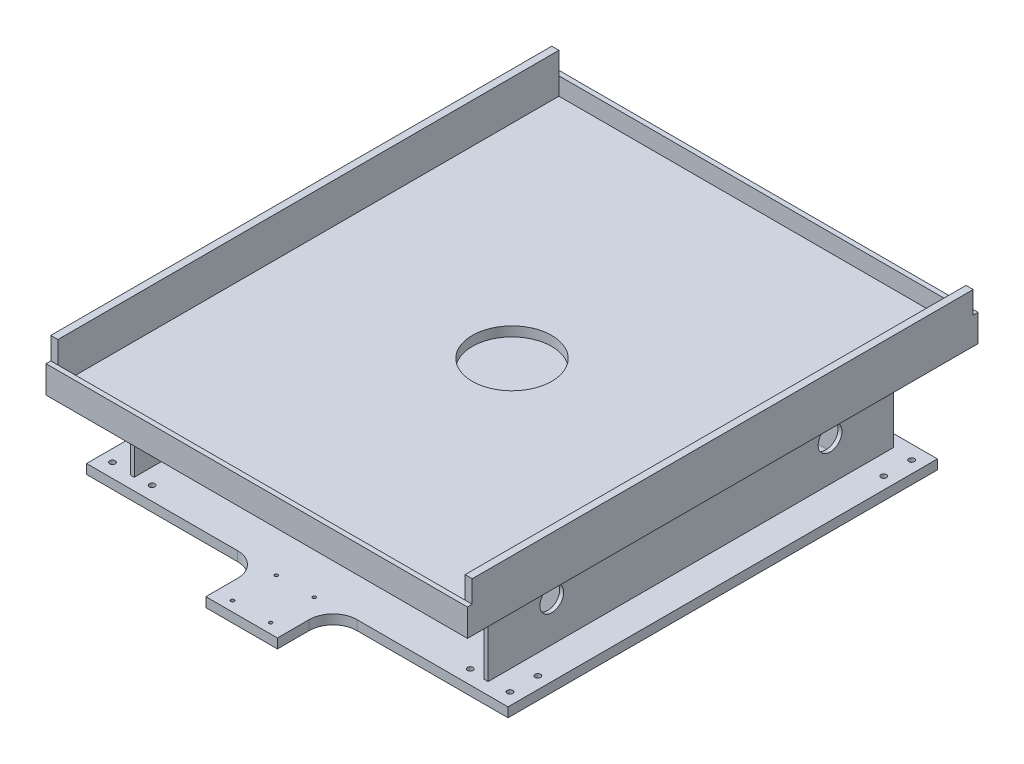
from build123d import *

# Parameters (mm, degrees)
SKETCH1_W                    = 530
SKETCH1_H                    = 680
BOSS_EXTRUDE1_DEPTH          = 12
BOSS_EXTRUDE2_START          = 220
SKETCH2_W                    = 510
SKETCH2_H                    = 100
BOSS_EXTRUDE2_DEPTH          = 5
BOSS_EXTRUDE3_START          = -220
SKETCH3_W                    = 510
SKETCH3_H                    = 100
BOSS_EXTRUDE3_DEPTH          = 5
SKETCH4_W                    = 50
SKETCH4_H                    = 100
SKETCH4_W_2                  = 44
SKETCH4_H_2                  = 94
EXTRUDE_THIN1_DEPTH          = 440
EXTRUDE_THIN1_2_DEPTH        = 440
SKETCH5_W                    = 530
SKETCH5_H                    = 642
BOSS_EXTRUDE4_DEPTH          = 62
SHELL1_T                     = -9
SHELL1_THICKNESS_2_FACE_W    = 624
SHELL1_THICKNESS_2_FACE_H    = 512
SHELL1_THICKNESS_2_DEPTH     = 3
SHELL1_THICKNESS_3_FACE_W    = 512
SHELL1_THICKNESS_3_FACE_H    = 50
SHELL1_THICKNESS_3_DEPTH     = 3
SHELL1_THICKNESS_4_FACE_W    = 512
SHELL1_THICKNESS_4_FACE_H    = 50
SHELL1_THICKNESS_4_DEPTH     = 3
FILLET1_R                    = 6
FILLET2_R                    = 9
FILLET3_R                    = 6
FILLET4_R                    = 9
SKETCH6_W                    = 530
SKETCH6_H                    = 6
CUT_EXTRUDE1_DEPTH           = 27.8
SKETCH7_W                    = 220
SKETCH7_H                    = 70
CUT_EXTRUDE2_DEPTH           = 748.575414256
SKETCH8_R                    = 50
CUT_EXTRUDE3_DEPTH           = 741.270896362
SKETCH9_R                    = 15
CUT_EXTRUDE4_DEPTH           = 857.023364167
M5X0_8_TAPPED_HOLE1_D        = 4.2
M5X0_8_TAPPED_HOLE1_DEPTH    = 12
LPATTERN1_COUNT              = 2
LPATTERN1_PITCH              = 600
F_7_0_7_DIAMETER_HOLE1_D     = 7
F_7_0_7_DIAMETER_HOLE1_DEPTH = 12
LPATTERN2_COUNT              = 2
LPATTERN2_PITCH              = 470
LPATTERN2_COPY_1_D           = 7
LPATTERN2_COPY_1_DEPTH       = 12
FILLET5_R                    = 30


with BuildPart() as part:
    # Sketch1 → Boss-Extrude1 (new body)
    with BuildSketch(Plane(origin=(0, 0, 0), x_dir=(1, 0, 0), z_dir=(0, 1, 0))):
        with Locations((0, 340)):
            Rectangle(SKETCH1_W, SKETCH1_H)
    extrude(amount=BOSS_EXTRUDE1_DEPTH)

    # Sketch2 → Boss-Extrude2 (add)
    with BuildSketch(Plane(origin=(0, 0, 0), x_dir=(0, 0, -1), z_dir=(1, 0, 0)).offset(BOSS_EXTRUDE2_START)):
        with Locations((340, 62)):
            Rectangle(SKETCH2_W, SKETCH2_H)
    extrude(amount=BOSS_EXTRUDE2_DEPTH)

    # Sketch3 → Boss-Extrude3 (add)
    with BuildSketch(Plane(origin=(0, 0, 0), x_dir=(0, 0, -1), z_dir=(1, 0, 0)).offset(BOSS_EXTRUDE3_START)):
        with Locations((340, 62)):
            Rectangle(SKETCH3_W, SKETCH3_H)
    extrude(amount=-BOSS_EXTRUDE3_DEPTH)


with BuildPart() as body_2:
    # Sketch4 → Extrude-Thin1 (new body)
    with BuildSketch(Plane(origin=(-220, 0, 0), x_dir=(0, 0, -1), z_dir=(1, 0, 0))):
        with Locations((160, 62)):
            Rectangle(SKETCH4_W, SKETCH4_H)
        with Locations((160, 62)):
            Rectangle(SKETCH4_W_2, SKETCH4_H_2, mode=Mode.SUBTRACT)
    extrude(amount=EXTRUDE_THIN1_DEPTH)

    # Fillet1
    fillet1_edges = [body_2.edges().sort_by_distance(p)[0] for p in [
        (0, 109, -182),
        (0, 109, -138),
        (0, 15, -182),
        (0, 15, -138),
    ]]
    fillet(fillet1_edges, radius=FILLET1_R)

    # Fillet2
    fillet2_edges = [body_2.edges().sort_by_distance(p)[0] for p in [
        (0, 112, -135),
        (0, 112, -185),
        (0, 12, -185),
        (0, 12, -135),
    ]]
    fillet(fillet2_edges, radius=FILLET2_R)


with BuildPart() as body_3:
    # Sketch4 → Extrude-Thin1 2 (new body)
    with BuildSketch(Plane(origin=(-220, 0, 0), x_dir=(0, 0, -1), z_dir=(1, 0, 0))):
        with Locations((520, 62)):
            Rectangle(SKETCH4_W, SKETCH4_H)
        with Locations((520, 62)):
            Rectangle(SKETCH4_W_2, SKETCH4_H_2, mode=Mode.SUBTRACT)
    extrude(amount=EXTRUDE_THIN1_2_DEPTH)

    # Fillet3
    fillet3_edges = [body_3.edges().sort_by_distance(p)[0] for p in [
        (0, 109, -542),
        (0, 109, -498),
        (0, 15, -542),
        (0, 15, -498),
    ]]
    fillet(fillet3_edges, radius=FILLET3_R)

    # Fillet4
    fillet4_edges = [body_3.edges().sort_by_distance(p)[0] for p in [
        (0, 112, -495),
        (0, 112, -545),
        (0, 12, -545),
        (0, 12, -495),
    ]]
    fillet(fillet4_edges, radius=FILLET4_R)


with BuildPart() as body_4:
    # Sketch5 → Boss-Extrude4 (new body)
    with BuildSketch(Plane(origin=(0, 112, 0), x_dir=(1, 0, 0), z_dir=(0, 1, 0))):
        with Locations((0, 340)):
            Rectangle(SKETCH5_W, SKETCH5_H)
    extrude(amount=BOSS_EXTRUDE4_DEPTH)

    # Shell1
    shell1_openings = [body_4.faces().sort_by_distance(p)[0] for p in [
        (0, 174, -340),
    ]]
    offset(amount=SHELL1_T, openings=shell1_openings, kind=Kind.INTERSECTION)

    # Shell1 thickness 2 face (on inner face of the shell) → Shell1 thickness 2 (add)
    with BuildSketch(Plane(origin=(0, 121, -340), x_dir=(0, 0, -1), z_dir=(0, -1, 0))):
        Rectangle(SHELL1_THICKNESS_2_FACE_W, SHELL1_THICKNESS_2_FACE_H)
    extrude(amount=-SHELL1_THICKNESS_2_DEPTH)

    # Shell1 thickness 3 face (on inner face of the shell) → Shell1 thickness 3 (cut)
    with BuildSketch(Plane(origin=(0, 149, -28), x_dir=(1, 0, 0), z_dir=(0, 0, 1))):
        Rectangle(SHELL1_THICKNESS_3_FACE_W, SHELL1_THICKNESS_3_FACE_H)
    extrude(amount=SHELL1_THICKNESS_3_DEPTH, mode=Mode.SUBTRACT)

    # Shell1 thickness 4 face (on inner face of the shell) → Shell1 thickness 4 (cut)
    with BuildSketch(Plane(origin=(0, 149, -652), x_dir=(-1, 0, 0), z_dir=(0, 0, -1))):
        Rectangle(SHELL1_THICKNESS_4_FACE_W, SHELL1_THICKNESS_4_FACE_H)
    extrude(amount=SHELL1_THICKNESS_4_DEPTH, mode=Mode.SUBTRACT)

    # Combine1: union body 2, body 3, part
    add(body_2.part)
    add(body_3.part)
    add(part.part)

    # Sketch6 → Cut-Extrude1 (cut)
    with BuildSketch(Plane(origin=(0, 174, 0), x_dir=(1, 0, 0), z_dir=(0, 1, 0))):
        with Locations((0, 22)):
            Rectangle(SKETCH6_W, SKETCH6_H)
        with Locations((0, 658)):
            Rectangle(SKETCH6_W, SKETCH6_H)
    extrude(amount=-CUT_EXTRUDE1_DEPTH, mode=Mode.SUBTRACT)

    # Sketch7 → Cut-Extrude2 (cut, through all)
    with BuildSketch(Plane(origin=(0, 12, 0), x_dir=(1, 0, 0), z_dir=(0, 1, 0))):
        with Locations((-155, 35)):
            Rectangle(SKETCH7_W, SKETCH7_H)
        with Locations((155, 35)):
            Rectangle(SKETCH7_W, SKETCH7_H)
        with Locations((155, 645)):
            Rectangle(SKETCH7_W, SKETCH7_H)
        with Locations((-155, 645)):
            Rectangle(SKETCH7_W, SKETCH7_H)
    extrude(amount=-CUT_EXTRUDE2_DEPTH, mode=Mode.SUBTRACT)

    # Sketch8 → Cut-Extrude3 (cut, through all)
    with BuildSketch(Plane(origin=(0, 124, 0), x_dir=(1, 0, 0), z_dir=(0, 1, 0))):
        with Locations(Location((0, 340, 0), (0, 0, 270))):
            Circle(SKETCH8_R)
    extrude(amount=-CUT_EXTRUDE3_DEPTH, mode=Mode.SUBTRACT)

    # Sketch9 → Cut-Extrude4 (cut, through all)
    with BuildSketch(Plane(origin=(225, 0, 0), x_dir=(0, 0, -1), z_dir=(1, 0, 0))):
        with Locations((165, 62)):
            Circle(SKETCH9_R)
        with Locations((515, 62)):
            Circle(SKETCH9_R)
    extrude(amount=-CUT_EXTRUDE4_DEPTH, mode=Mode.SUBTRACT)

    # M5x0.8 Tapped Hole1
    with Locations(Plane(origin=(0, 12, 0), x_dir=(-1, 0, 0), z_dir=(0, 1, 0))):
        with Locations((-24, -12.5), (24, -12.5), (-24, -67.5), (24, -67.5)):
            m5x0_8_tapped_hole1 = Hole(M5X0_8_TAPPED_HOLE1_D / 2, depth=M5X0_8_TAPPED_HOLE1_DEPTH)

    # LPattern1: M5x0.8 Tapped Hole1 ×2
    with Locations(*[(0, 0, -i * LPATTERN1_PITCH) for i in range(1, LPATTERN1_COUNT)]):
        add(m5x0_8_tapped_hole1, mode=Mode.SUBTRACT)

    # Ø7.0 (7) Diameter Hole1
    with Locations(Plane(origin=(0, 12, 0), x_dir=(-1, 0, 0), z_dir=(0, 1, 0))):
        with Locations((-200, -122.5), (-200, -87.5), (-250, -122.5), (-250, -87.5)):
            f_7_0_7_diameter_hole1 = Hole(F_7_0_7_DIAMETER_HOLE1_D / 2, depth=F_7_0_7_DIAMETER_HOLE1_DEPTH)

    # Mirror1: Ø7.0 (7) Diameter Hole1 across plane
    add(f_7_0_7_diameter_hole1.mirror(Plane(origin=(0, 0, 0), x_dir=(0, 0, 1), z_dir=(1, 0, 0))), mode=Mode.SUBTRACT)

    # LPattern2: Ø7.0 (7) Diameter Hole1 ×2
    with Locations(*[(0, 0, -i * LPATTERN2_PITCH) for i in range(1, LPATTERN2_COUNT)]):
        add(f_7_0_7_diameter_hole1, mode=Mode.SUBTRACT)

    # LPattern2 copy 1
    with Locations(Plane(origin=(0, 12, -470), x_dir=(1, 0, 0), z_dir=(0, 1, 0))):
        with Locations((-200, 122.5), (-200, 87.5), (-250, 122.5), (-250, 87.5)):
            Hole(LPATTERN2_COPY_1_D / 2, depth=LPATTERN2_COPY_1_DEPTH)

    # Fillet5
    fillet5_edges = [body_4.edges().sort_by_distance(p)[0] for p in [
        (-45, 6, -70),
        (45, 6, -70),
        (45, 6, -610),
        (-45, 6, -610),
    ]]
    fillet(fillet5_edges, radius=FILLET5_R)


solid = body_4.part
